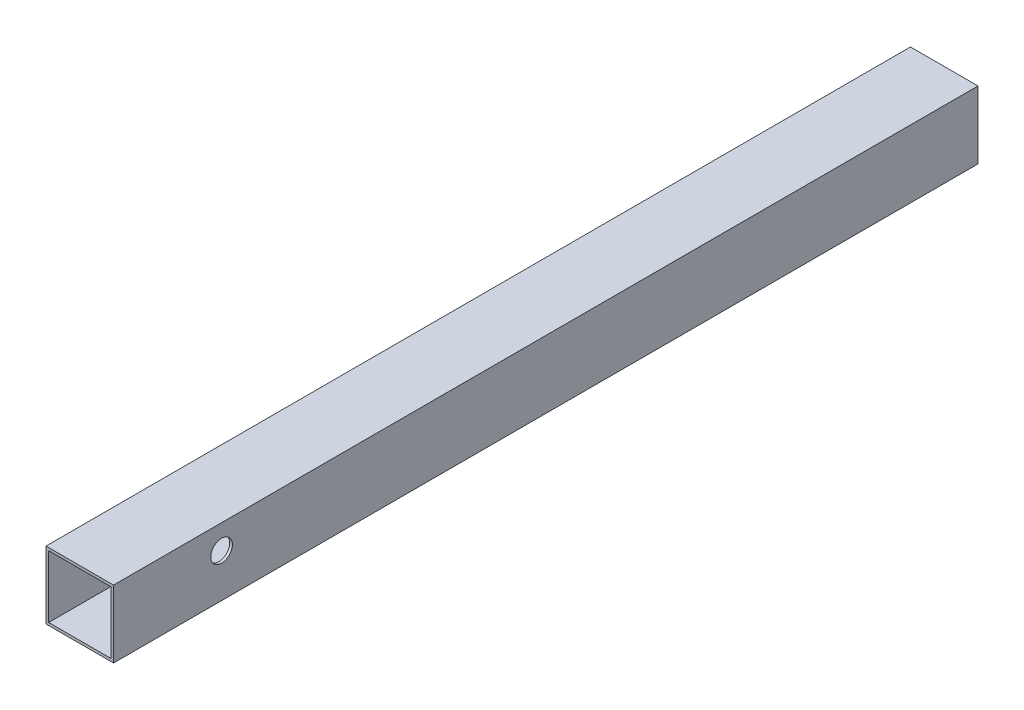
from build123d import *

# Parameters (mm, degrees)
SKETCH1_W           = 25
SKETCH1_H           = 25
SKETCH1_W_2         = 23
SKETCH1_H_2         = 23
BOSS_EXTRUDE1_DEPTH = 320
SKETCH2_R           = 4
CUT_EXTRUDE1_DEPTH  = 322.218383658


with BuildPart() as part:
    # Sketch1 → Boss-Extrude1 (new body)
    with BuildSketch(Plane.XY):
        Rectangle(SKETCH1_W, SKETCH1_H)
        Rectangle(SKETCH1_W_2, SKETCH1_H_2, mode=Mode.SUBTRACT)
    extrude(amount=BOSS_EXTRUDE1_DEPTH)

    # Sketch2 → Cut-Extrude1 (cut, through all)
    with BuildSketch(Plane(origin=(12.5, 0, 0), x_dir=(0, 0, -1), z_dir=(1, 0, 0))):
        with Locations((-280, 3.5)):
            Circle(SKETCH2_R)
    extrude(amount=-CUT_EXTRUDE1_DEPTH, mode=Mode.SUBTRACT)


solid = part.part
